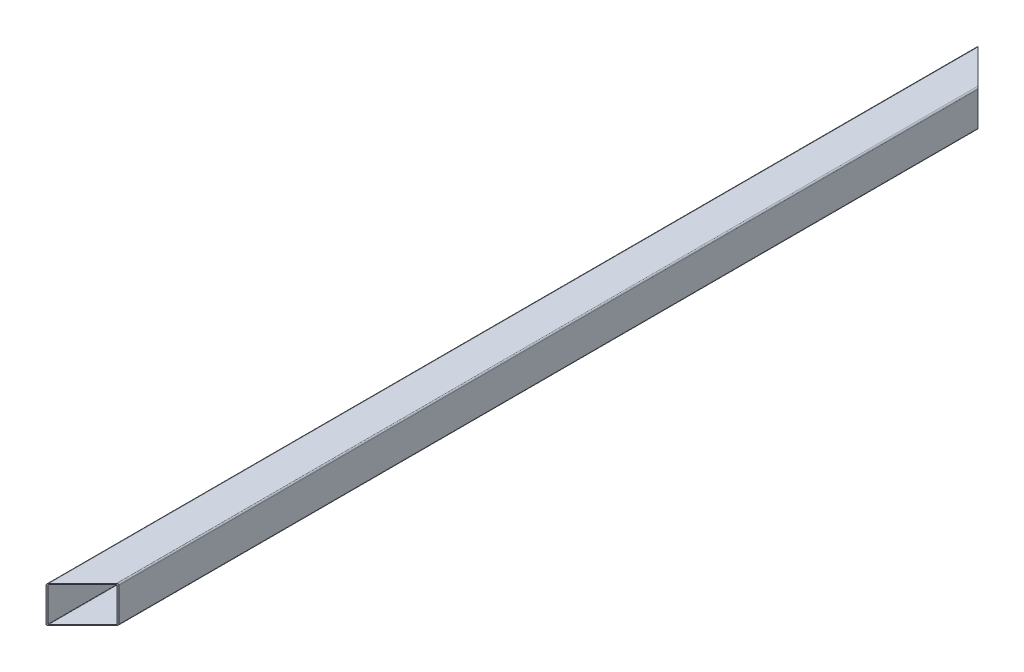
from build123d import *

# Parameters (mm, degrees)
STRUCTURAL_MEMBER1_DEPTH = 1020
CUT_EXTRUDE1_DEPTH       = 647


with BuildPart() as part:
    # Sketch12 → Structural Member1 (new body)
    with BuildSketch(Plane(origin=(0, 0, 0), x_dir=(-1, 0, 0), z_dir=(0, 0, -1))):
        with BuildLine():
            Line((-18.5, -20), (18.5, -20))
            ThreePointArc((18.5, -20), (19.560660172, -19.560660172), (20, -18.5))
            Line((20, -18.5), (20, 18.5))
            ThreePointArc((20, 18.5), (19.560660172, 19.560660172), (18.5, 20))
            Line((18.5, 20), (-18.5, 20))
            ThreePointArc((-18.5, 20), (-19.560660172, 19.560660172), (-20, 18.5))
            Line((-20, 18.5), (-20, -18.5))
            ThreePointArc((-20, -18.5), (-19.560660172, -19.560660172), (-18.5, -20))
        make_face()
        with BuildLine():
            Line((-18.5, -18.8), (18.5, -18.8))
            ThreePointArc((18.5, -18.8), (18.712132034, -18.712132034), (18.8, -18.5))
            Line((18.8, -18.5), (18.8, 18.5))
            ThreePointArc((18.8, 18.5), (18.712132034, 18.712132034), (18.5, 18.8))
            Line((18.5, 18.8), (-18.5, 18.8))
            ThreePointArc((-18.5, 18.8), (-18.712132034, 18.712132034), (-18.8, 18.5))
            Line((-18.8, 18.5), (-18.8, -18.5))
            ThreePointArc((-18.8, -18.5), (-18.712132034, -18.712132034), (-18.5, -18.8))
        make_face(mode=Mode.SUBTRACT)
    extrude(amount=STRUCTURAL_MEMBER1_DEPTH)

    # Sketch13 → Cut-Extrude1 (cut)
    with BuildSketch(Plane(origin=(0, 50, 0), x_dir=(1, 0, 0), z_dir=(0, 1, 0))):
        Polygon((-20, 1020), (38.737229193, 961.262770807), (38.737229193, 1020), align=None)
        Polygon((-20, 0), (47.91999708, 67.91999708), (47.91999708, 0), align=None)
    extrude(amount=-CUT_EXTRUDE1_DEPTH, mode=Mode.SUBTRACT)


solid = part.part
